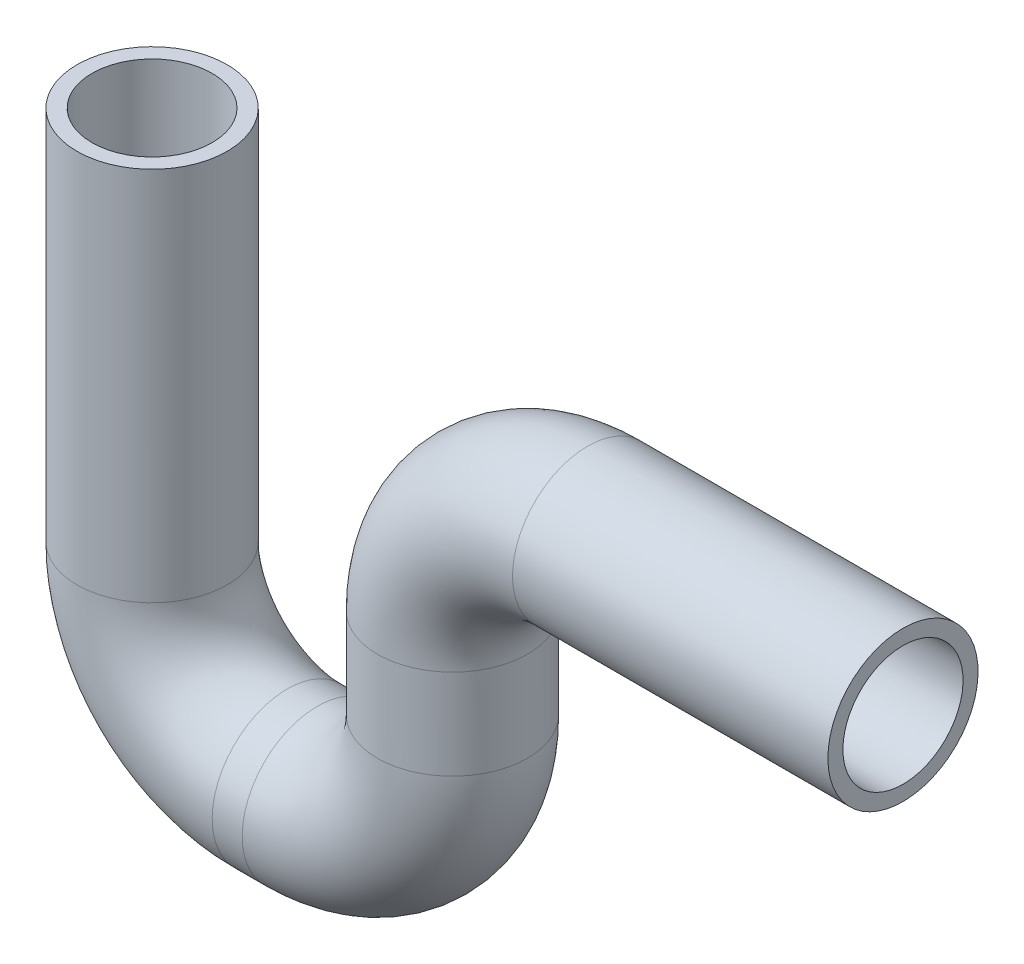
from build123d import *

# Parameters (mm, degrees)
CROQUIS3_R   = 25
CROQUIS3_R_2 = 20


with BuildPart() as part:
    # Barrer1: sweep along a path in Croquis2
    with BuildLine(Plane.XY) as barrer1_path:
        Line((0, 0), (0, -125))
        ThreePointArc((0, -125), (13.180194847, -156.819805153), (45, -170))
        Line((45, -170), (55, -170))
        ThreePointArc((55, -170), (86.819805153, -156.819805153), (100, -125))
        Line((100, -125), (100, -95))
        ThreePointArc((100, -95), (113.180194847, -63.180194847), (145, -50))
        Line((145, -50), (250, -50))
    # Croquis3 → Barrer1 (sweep)
    with BuildSketch(Plane(origin=(0, 0, 0), x_dir=(1, 0, 0), z_dir=(0, 1, 0))):
        Circle(CROQUIS3_R)
        Circle(CROQUIS3_R_2, mode=Mode.SUBTRACT)
    sweep(path=barrer1_path.line)


solid = part.part
